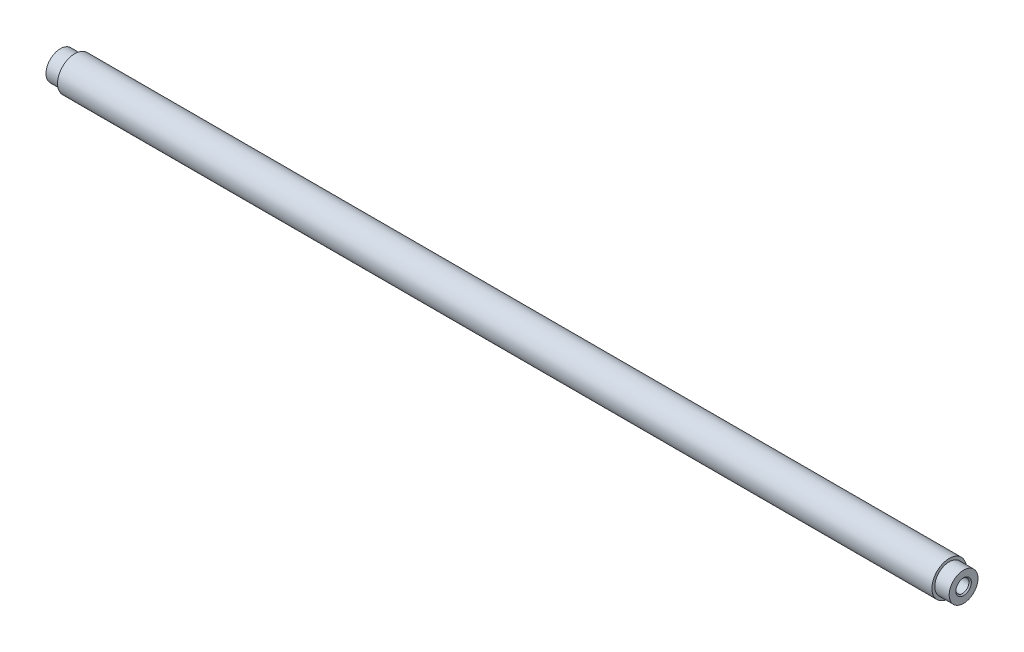
from build123d import *


with BuildPart() as part:
    # Sketch1 → Revolve1 (revolve)
    with BuildSketch(Plane.XY, mode=Mode.PRIVATE) as revolve1_sk:
        Polygon((-235, 0), (235, 0), (235, 7.5), (227.5, 7.5), (227.5, 9), (-227.5, 9), (-227.5, 7.5), (-235, 7.5), align=None)
    revolve(revolve1_sk.sketch.rotate(Axis((-235, 0, 0), (1, 0, 0)), 180), axis=Axis((-235, 0, 0), (1, 0, 0)))

    # Sketch5 → M8 Tapped Hole2 (revolve, cut)
    with BuildSketch(Plane(origin=(235, 0, 0), x_dir=(0, 0, -1), z_dir=(0, 1, 0))):
        Polygon((0, 0), (0, 22.042926105), (3.4, 20), (3.4, 0.625), (4.025, 0), align=None)
    m8_tapped_hole2 = revolve(axis=Axis((241.35, 0, 0), (-1, 0, 0)), mode=Mode.SUBTRACT)

    # Mirror1: M8 Tapped Hole2 across plane
    add(m8_tapped_hole2.mirror(Plane(origin=(0, 0, 0), x_dir=(0, 0, 1), z_dir=(1, 0, 0))), mode=Mode.SUBTRACT)


solid = part.part
